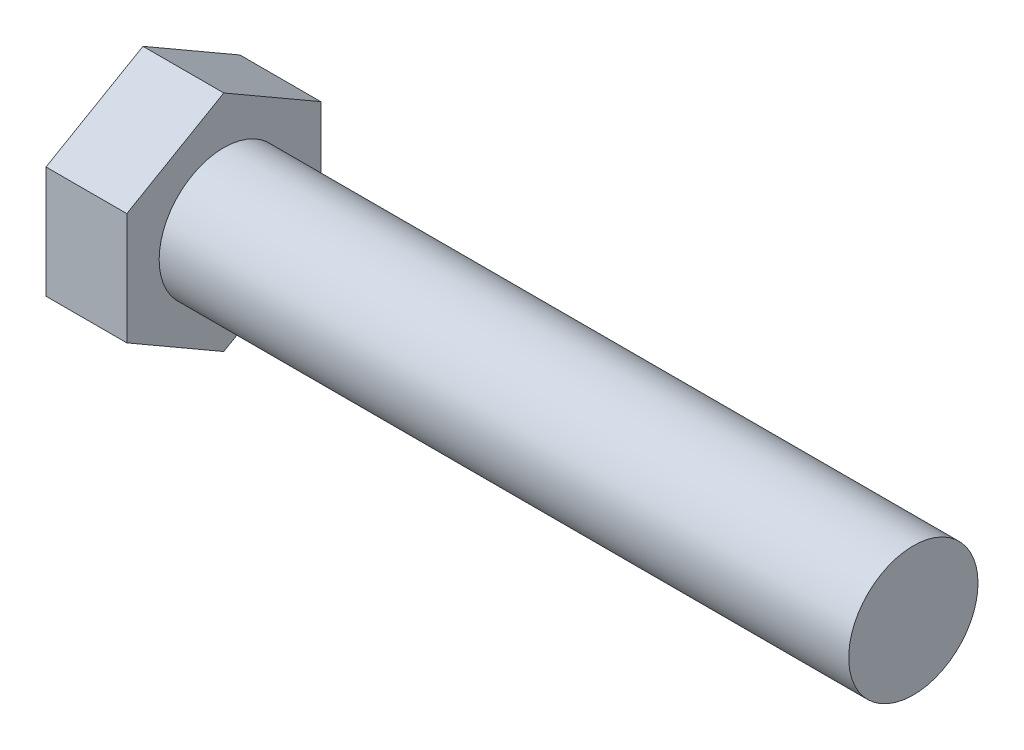
from build123d import *

# Parameters (mm, degrees)
SKETCH5_R           = 4.7625
BOSS_EXTRUDE3_DEPTH = 50.8
BOSS_EXTRUDE4_DEPTH = 5.953125


with BuildPart() as part:
    # Sketch5 → Boss-Extrude3 (new body)
    with BuildSketch(Plane(origin=(28.3765625, 0, 0), x_dir=(0, 0, -1), z_dir=(1, 0, 0))):
        Circle(SKETCH5_R)
    extrude(amount=-BOSS_EXTRUDE3_DEPTH)

    # Sketch11 → Revolve1 (revolve)
    with BuildSketch(Plane.XY):
        Polygon((-22.4234375, 4.7625), (-22.4234375, 0), (14.0890625, 0), (9.3265625, 4.7625), align=None)
    revolve(axis=Axis((-22.4234375, 0, 0), (1, 0, 0)))

    # Sketch6 → Boss-Extrude4 (add)
    with BuildSketch(Plane.ZY.offset(22.4234375)):
        Polygon((7.14375, 4.124445986), (0, 8.248891971), (-7.14375, 4.124445986), (-7.14375, -4.124445986), (0, -8.248891971), (7.14375, -4.124445986), align=None)
    extrude(amount=BOSS_EXTRUDE4_DEPTH)


solid = part.part
